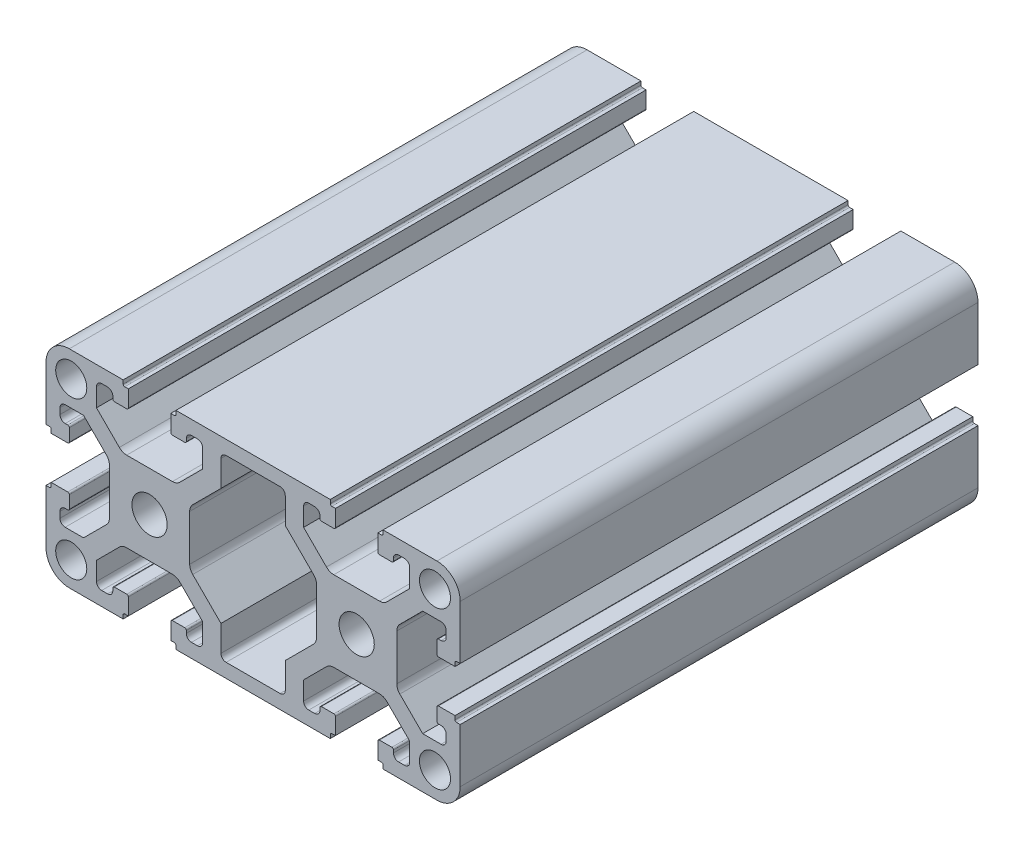
from build123d import *

# Parameters (mm, degrees)
SKETCH_1_R      = 3.4
SKETCH_1_R_2    = 3
EXTRUDE_1_DEPTH = 100


with BuildPart() as part:
    # 草图1 → 凸台-拉伸1 (new body)
    with BuildSketch(Plane.XY):
        with BuildLine():
            Line((-25.8856131, 19.848597475), (-36.2856131, 19.848597475))
            ThreePointArc((-36.2856131, 19.848597475), (-39.467593615, 18.530577991), (-40.7856131, 15.348597475))
            Line((-40.7856131, 15.348597475), (-40.7856131, 4.948597475))
            Line((-40.7856131, 4.948597475), (-40.0856131, 4.948597475))
            ThreePointArc((-40.0856131, 4.948597475), (-39.873481065, 4.86072951), (-39.7856131, 4.648597475))
            Line((-39.7856131, 4.648597475), (-39.7856131, 3.948597475))
            Line((-39.7856131, 3.948597475), (-36.5856131, 3.948597475))
            ThreePointArc((-36.5856131, 3.948597475), (-36.373481065, 4.036465441), (-36.2856131, 4.248597475))
            Line((-36.2856131, 4.248597475), (-36.2856131, 6.648597475))
            ThreePointArc((-36.2856131, 6.648597475), (-36.373481065, 6.86072951), (-36.5856131, 6.948597475))
            Line((-36.5856131, 6.948597475), (-37.0856131, 6.948597475))
            ThreePointArc((-37.0856131, 6.948597475), (-37.792719881, 7.241490694), (-38.0856131, 7.948597475))
            Line((-38.0856131, 7.948597475), (-38.0856131, 9.098597475))
            ThreePointArc((-38.0856131, 9.098597475), (-37.792719881, 9.805704257), (-37.0856131, 10.098597475))
            Line((-37.0856131, 10.098597475), (-33.538771105, 10.098597475))
            Line((-33.538771105, 10.098597475), (-29.121399537, 5.681225908))
            ThreePointArc((-29.121399537, 5.681225908), (-28.687854035, 5.03237921), (-28.5356131, 4.267012345))
            Line((-28.5356131, 4.267012345), (-28.5356131, -4.569817394))
            ThreePointArc((-28.5356131, -4.569817394), (-28.687854035, -5.335184259), (-29.121399537, -5.984030957))
            Line((-29.121399537, -5.984030957), (-33.538771105, -10.401402525))
            Line((-33.538771105, -10.401402525), (-37.0856131, -10.401402525))
            ThreePointArc((-37.0856131, -10.401402525), (-37.792719881, -10.108509306), (-38.0856131, -9.401402525))
            Line((-38.0856131, -9.401402525), (-38.0856131, -8.251402525))
            ThreePointArc((-38.0856131, -8.251402525), (-37.792719881, -7.544295743), (-37.0856131, -7.251402525))
            Line((-37.0856131, -7.251402525), (-36.5856131, -7.251402525))
            ThreePointArc((-36.5856131, -7.251402525), (-36.373481065, -7.163534559), (-36.2856131, -6.951402525))
            Line((-36.2856131, -6.951402525), (-36.2856131, -4.551402525))
            ThreePointArc((-36.2856131, -4.551402525), (-36.373481065, -4.33927049), (-36.5856131, -4.251402525))
            Line((-36.5856131, -4.251402525), (-39.7856131, -4.251402525))
            Line((-39.7856131, -4.251402525), (-39.7856131, -4.951402525))
            ThreePointArc((-39.7856131, -4.951402525), (-39.873481065, -5.163534559), (-40.0856131, -5.251402525))
            Line((-40.0856131, -5.251402525), (-40.7856131, -5.251402525))
            Line((-40.7856131, -5.251402525), (-40.7856131, -15.651402525))
            ThreePointArc((-40.7856131, -15.651402525), (-39.467593615, -18.83338304), (-36.2856131, -20.151402525))
            Line((-36.2856131, -20.151402525), (-25.8856131, -20.151402525))
            Line((-25.8856131, -20.151402525), (-25.8856131, -19.451402525))
            ThreePointArc((-25.8856131, -19.451402525), (-25.797745134, -19.23927049), (-25.5856131, -19.151402525))
            Line((-25.5856131, -19.151402525), (-24.8856131, -19.151402525))
            Line((-24.8856131, -19.151402525), (-24.8856131, -15.951402525))
            ThreePointArc((-24.8856131, -15.951402525), (-24.973481065, -15.73927049), (-25.1856131, -15.651402525))
            Line((-25.1856131, -15.651402525), (-27.5856131, -15.651402525))
            ThreePointArc((-27.5856131, -15.651402525), (-27.797745134, -15.73927049), (-27.8856131, -15.951402525))
            Line((-27.8856131, -15.951402525), (-27.8856131, -16.451402525))
            ThreePointArc((-27.8856131, -16.451402525), (-28.178506318, -17.158509306), (-28.8856131, -17.451402525))
            Line((-28.8856131, -17.451402525), (-30.0356131, -17.451402525))
            ThreePointArc((-30.0356131, -17.451402525), (-30.742719881, -17.158509306), (-31.0356131, -16.451402525))
            Line((-31.0356131, -16.451402525), (-31.0356131, -12.90456053))
            Line((-31.0356131, -12.90456053), (-26.618241532, -8.487188962))
            ThreePointArc((-26.618241532, -8.487188962), (-25.969394834, -8.05364346), (-25.204027969, -7.901402525))
            Line((-25.204027969, -7.901402525), (-16.36719823, -7.901402525))
            ThreePointArc((-16.36719823, -7.901402525), (-15.601831365, -8.05364346), (-14.952984667, -8.487188962))
            Line((-14.952984667, -8.487188962), (-10.5356131, -12.90456053))
            Line((-10.5356131, -12.90456053), (-10.5356131, -16.451402525))
            ThreePointArc((-10.5356131, -16.451402525), (-10.828506318, -17.158509306), (-11.5356131, -17.451402525))
            Line((-11.5356131, -17.451402525), (-12.6856131, -17.451402525))
            ThreePointArc((-12.6856131, -17.451402525), (-13.392719881, -17.158509306), (-13.6856131, -16.451402525))
            Line((-13.6856131, -16.451402525), (-13.6856131, -15.951402525))
            ThreePointArc((-13.6856131, -15.951402525), (-13.773481065, -15.73927049), (-13.9856131, -15.651402525))
            Line((-13.9856131, -15.651402525), (-16.3856131, -15.651402525))
            ThreePointArc((-16.3856131, -15.651402525), (-16.597745134, -15.73927049), (-16.6856131, -15.951402525))
            Line((-16.6856131, -15.951402525), (-16.6856131, -19.151402525))
            Line((-16.6856131, -19.151402525), (-15.9856131, -19.151402525))
            ThreePointArc((-15.9856131, -19.151402525), (-15.773481065, -19.23927049), (-15.6856131, -19.451402525))
            Line((-15.6856131, -19.451402525), (-15.6856131, -20.151402525))
            Line((-15.6856131, -20.151402525), (-5.2856131, -20.151402525))
            Line((-5.2856131, -20.151402525), (14.1143869, -20.151402525))
            Line((14.1143869, -20.151402525), (14.1143869, -19.451402525))
            ThreePointArc((14.1143869, -19.451402525), (14.202254866, -19.23927049), (14.4143869, -19.151402525))
            Line((14.4143869, -19.151402525), (15.1143869, -19.151402525))
            Line((15.1143869, -19.151402525), (15.1143869, -15.951402525))
            ThreePointArc((15.1143869, -15.951402525), (15.026518935, -15.73927049), (14.8143869, -15.651402525))
            Line((14.8143869, -15.651402525), (12.4143869, -15.651402525))
            ThreePointArc((12.4143869, -15.651402525), (12.202254866, -15.73927049), (12.1143869, -15.951402525))
            Line((12.1143869, -15.951402525), (12.1143869, -16.451402525))
            ThreePointArc((12.1143869, -16.451402525), (11.821493682, -17.158509306), (11.1143869, -17.451402525))
            Line((11.1143869, -17.451402525), (9.9643869, -17.451402525))
            ThreePointArc((9.9643869, -17.451402525), (9.257280119, -17.158509306), (8.9643869, -16.451402525))
            Line((8.9643869, -16.451402525), (8.9643869, -12.90456053))
            Line((8.9643869, -12.90456053), (13.381758468, -8.487188962))
            ThreePointArc((13.381758468, -8.487188962), (14.030605166, -8.05364346), (14.795972031, -7.901402525))
            Line((14.795972031, -7.901402525), (23.63280177, -7.901402525))
            ThreePointArc((23.63280177, -7.901402525), (24.398168635, -8.05364346), (25.047015333, -8.487188962))
            Line((25.047015333, -8.487188962), (29.4643869, -12.90456053))
            Line((29.4643869, -12.90456053), (29.4643869, -16.451402525))
            ThreePointArc((29.4643869, -16.451402525), (29.171493682, -17.158509306), (28.4643869, -17.451402525))
            Line((28.4643869, -17.451402525), (27.3143869, -17.451402525))
            ThreePointArc((27.3143869, -17.451402525), (26.607280119, -17.158509306), (26.3143869, -16.451402525))
            Line((26.3143869, -16.451402525), (26.3143869, -15.951402525))
            ThreePointArc((26.3143869, -15.951402525), (26.226518935, -15.73927049), (26.0143869, -15.651402525))
            Line((26.0143869, -15.651402525), (23.6143869, -15.651402525))
            ThreePointArc((23.6143869, -15.651402525), (23.402254866, -15.73927049), (23.3143869, -15.951402525))
            Line((23.3143869, -15.951402525), (23.3143869, -19.151402525))
            Line((23.3143869, -19.151402525), (24.0143869, -19.151402525))
            ThreePointArc((24.0143869, -19.151402525), (24.226518935, -19.23927049), (24.3143869, -19.451402525))
            Line((24.3143869, -19.451402525), (24.3143869, -20.151402525))
            Line((24.3143869, -20.151402525), (34.7143869, -20.151402525))
            ThreePointArc((34.7143869, -20.151402525), (37.896367416, -18.83338304), (39.2143869, -15.651402525))
            Line((39.2143869, -15.651402525), (39.2143869, -5.251402525))
            Line((39.2143869, -5.251402525), (38.5143869, -5.251402525))
            ThreePointArc((38.5143869, -5.251402525), (38.302254866, -5.163534559), (38.2143869, -4.951402525))
            Line((38.2143869, -4.951402525), (38.2143869, -4.251402525))
            Line((38.2143869, -4.251402525), (35.0143869, -4.251402525))
            ThreePointArc((35.0143869, -4.251402525), (34.802254866, -4.33927049), (34.7143869, -4.551402525))
            Line((34.7143869, -4.551402525), (34.7143869, -6.951402525))
            ThreePointArc((34.7143869, -6.951402525), (34.802254866, -7.163534559), (35.0143869, -7.251402525))
            Line((35.0143869, -7.251402525), (35.5143869, -7.251402525))
            ThreePointArc((35.5143869, -7.251402525), (36.221493682, -7.544295743), (36.5143869, -8.251402525))
            Line((36.5143869, -8.251402525), (36.5143869, -9.401402525))
            ThreePointArc((36.5143869, -9.401402525), (36.221493682, -10.108509306), (35.5143869, -10.401402525))
            Line((35.5143869, -10.401402525), (31.967544906, -10.401402525))
            Line((31.967544906, -10.401402525), (27.550173338, -5.984030957))
            ThreePointArc((27.550173338, -5.984030957), (27.116627835, -5.335184259), (26.9643869, -4.569817394))
            Line((26.9643869, -4.569817394), (26.9643869, 4.267012345))
            ThreePointArc((26.9643869, 4.267012345), (27.116627835, 5.03237921), (27.550173338, 5.681225908))
            Line((27.550173338, 5.681225908), (31.967544906, 10.098597475))
            Line((31.967544906, 10.098597475), (35.5143869, 10.098597475))
            ThreePointArc((35.5143869, 10.098597475), (36.221493682, 9.805704257), (36.5143869, 9.098597475))
            Line((36.5143869, 9.098597475), (36.5143869, 7.948597475))
            ThreePointArc((36.5143869, 7.948597475), (36.221493682, 7.241490694), (35.5143869, 6.948597475))
            Line((35.5143869, 6.948597475), (35.0143869, 6.948597475))
            ThreePointArc((35.0143869, 6.948597475), (34.802254866, 6.86072951), (34.7143869, 6.648597475))
            Line((34.7143869, 6.648597475), (34.7143869, 4.248597475))
            ThreePointArc((34.7143869, 4.248597475), (34.802254866, 4.036465441), (35.0143869, 3.948597475))
            Line((35.0143869, 3.948597475), (38.2143869, 3.948597475))
            Line((38.2143869, 3.948597475), (38.2143869, 4.648597475))
            ThreePointArc((38.2143869, 4.648597475), (38.302254866, 4.86072951), (38.5143869, 4.948597475))
            Line((38.5143869, 4.948597475), (39.2143869, 4.948597475))
            Line((39.2143869, 4.948597475), (39.2143869, 15.348597475))
            ThreePointArc((39.2143869, 15.348597475), (37.896367416, 18.530577991), (34.7143869, 19.848597475))
            Line((34.7143869, 19.848597475), (24.3143869, 19.848597475))
            Line((24.3143869, 19.848597475), (24.3143869, 19.148597475))
            ThreePointArc((24.3143869, 19.148597475), (24.226518935, 18.936465441), (24.0143869, 18.848597475))
            Line((24.0143869, 18.848597475), (23.3143869, 18.848597475))
            Line((23.3143869, 18.848597475), (23.3143869, 15.648597475))
            ThreePointArc((23.3143869, 15.648597475), (23.402254866, 15.436465441), (23.6143869, 15.348597475))
            Line((23.6143869, 15.348597475), (26.0143869, 15.348597475))
            ThreePointArc((26.0143869, 15.348597475), (26.226518935, 15.436465441), (26.3143869, 15.648597475))
            Line((26.3143869, 15.648597475), (26.3143869, 16.148597475))
            ThreePointArc((26.3143869, 16.148597475), (26.607280119, 16.855704257), (27.3143869, 17.148597475))
            Line((27.3143869, 17.148597475), (28.4643869, 17.148597475))
            ThreePointArc((28.4643869, 17.148597475), (29.171493682, 16.855704257), (29.4643869, 16.148597475))
            Line((29.4643869, 16.148597475), (29.4643869, 12.601755481))
            Line((29.4643869, 12.601755481), (25.047015333, 8.184383913))
            ThreePointArc((25.047015333, 8.184383913), (24.398168635, 7.75083841), (23.63280177, 7.598597475))
            Line((23.63280177, 7.598597475), (14.795972031, 7.598597475))
            ThreePointArc((14.795972031, 7.598597475), (14.030605166, 7.75083841), (13.381758468, 8.184383913))
            Line((13.381758468, 8.184383913), (8.9643869, 12.601755481))
            Line((8.9643869, 12.601755481), (8.9643869, 16.148597475))
            ThreePointArc((8.9643869, 16.148597475), (9.257280119, 16.855704257), (9.9643869, 17.148597475))
            Line((9.9643869, 17.148597475), (11.1143869, 17.148597475))
            ThreePointArc((11.1143869, 17.148597475), (11.821493682, 16.855704257), (12.1143869, 16.148597475))
            Line((12.1143869, 16.148597475), (12.1143869, 15.648597475))
            ThreePointArc((12.1143869, 15.648597475), (12.202254866, 15.436465441), (12.4143869, 15.348597475))
            Line((12.4143869, 15.348597475), (14.8143869, 15.348597475))
            ThreePointArc((14.8143869, 15.348597475), (15.026518935, 15.436465441), (15.1143869, 15.648597475))
            Line((15.1143869, 15.648597475), (15.1143869, 18.848597475))
            Line((15.1143869, 18.848597475), (14.4143869, 18.848597475))
            ThreePointArc((14.4143869, 18.848597475), (14.202254866, 18.936465441), (14.1143869, 19.148597475))
            Line((14.1143869, 19.148597475), (14.1143869, 19.848597475))
            Line((14.1143869, 19.848597475), (3.7143869, 19.848597475))
            Line((3.7143869, 19.848597475), (-5.2856131, 19.848597475))
            Line((-5.2856131, 19.848597475), (-15.6856131, 19.848597475))
            Line((-15.6856131, 19.848597475), (-15.6856131, 19.148597475))
            ThreePointArc((-15.6856131, 19.148597475), (-15.773481065, 18.936465441), (-15.9856131, 18.848597475))
            Line((-15.9856131, 18.848597475), (-16.6856131, 18.848597475))
            Line((-16.6856131, 18.848597475), (-16.6856131, 15.648597475))
            ThreePointArc((-16.6856131, 15.648597475), (-16.597745134, 15.436465441), (-16.3856131, 15.348597475))
            Line((-16.3856131, 15.348597475), (-13.9856131, 15.348597475))
            ThreePointArc((-13.9856131, 15.348597475), (-13.773481065, 15.436465441), (-13.6856131, 15.648597475))
            Line((-13.6856131, 15.648597475), (-13.6856131, 16.148597475))
            ThreePointArc((-13.6856131, 16.148597475), (-13.392719881, 16.855704257), (-12.6856131, 17.148597475))
            Line((-12.6856131, 17.148597475), (-11.5356131, 17.148597475))
            ThreePointArc((-11.5356131, 17.148597475), (-10.828506318, 16.855704257), (-10.5356131, 16.148597475))
            Line((-10.5356131, 16.148597475), (-10.5356131, 12.601755481))
            Line((-10.5356131, 12.601755481), (-14.952984667, 8.184383913))
            ThreePointArc((-14.952984667, 8.184383913), (-15.601831365, 7.75083841), (-16.36719823, 7.598597475))
            Line((-16.36719823, 7.598597475), (-25.204027969, 7.598597475))
            ThreePointArc((-25.204027969, 7.598597475), (-25.969394834, 7.75083841), (-26.618241532, 8.184383913))
            Line((-26.618241532, 8.184383913), (-31.0356131, 12.601755481))
            Line((-31.0356131, 12.601755481), (-31.0356131, 16.148597475))
            ThreePointArc((-31.0356131, 16.148597475), (-30.742719881, 16.855704257), (-30.0356131, 17.148597475))
            Line((-30.0356131, 17.148597475), (-28.8856131, 17.148597475))
            ThreePointArc((-28.8856131, 17.148597475), (-28.178506318, 16.855704257), (-27.8856131, 16.148597475))
            Line((-27.8856131, 16.148597475), (-27.8856131, 15.648597475))
            ThreePointArc((-27.8856131, 15.648597475), (-27.797745134, 15.436465441), (-27.5856131, 15.348597475))
            Line((-27.5856131, 15.348597475), (-25.1856131, 15.348597475))
            ThreePointArc((-25.1856131, 15.348597475), (-24.973481065, 15.436465441), (-24.8856131, 15.648597475))
            Line((-24.8856131, 15.648597475), (-24.8856131, 18.848597475))
            Line((-24.8856131, 18.848597475), (-25.5856131, 18.848597475))
            ThreePointArc((-25.5856131, 18.848597475), (-25.797745134, 18.936465441), (-25.8856131, 19.148597475))
            Line((-25.8856131, 19.148597475), (-25.8856131, 19.848597475))
        make_face()
        with Locations((-20.7856131, -0.151402525)):
            Circle(SKETCH_1_R, mode=Mode.SUBTRACT)
        with Locations((-35.9106131, 14.973597475)):
            Circle(SKETCH_1_R_2, mode=Mode.SUBTRACT)
        with Locations((-35.9106131, -15.276402525)):
            Circle(SKETCH_1_R_2, mode=Mode.SUBTRACT)
        with Locations((19.2143869, -0.151402525)):
            Circle(SKETCH_1_R, mode=Mode.SUBTRACT)
        with Locations((34.3393869, 14.973597475)):
            Circle(SKETCH_1_R_2, mode=Mode.SUBTRACT)
        with Locations((34.3393869, -15.276402525)):
            Circle(SKETCH_1_R_2, mode=Mode.SUBTRACT)
        with BuildLine():
            Line((-6.9956131, -11.438244519), (-12.449826662, -5.984030957))
            ThreePointArc((-12.449826662, -5.984030957), (-12.883372165, -5.335184259), (-13.0356131, -4.569817394))
            Line((-13.0356131, -4.569817394), (-13.0356131, 4.267012345))
            ThreePointArc((-13.0356131, 4.267012345), (-12.883372165, 5.03237921), (-12.449826662, 5.681225908))
            Line((-12.449826662, 5.681225908), (-6.9956131, 11.13543947))
            Line((-6.9956131, 11.13543947), (-6.9956131, 16.148597475))
            ThreePointArc((-6.9956131, 16.148597475), (-6.702719881, 16.855704257), (-5.9956131, 17.148597475))
            Line((-5.9956131, 17.148597475), (4.4243869, 17.148597475))
            ThreePointArc((4.4243869, 17.148597475), (5.131493682, 16.855704257), (5.4243869, 16.148597475))
            Line((5.4243869, 16.148597475), (5.4243869, 11.13543947))
            Line((5.4243869, 11.13543947), (10.878600463, 5.681225908))
            ThreePointArc((10.878600463, 5.681225908), (11.312145965, 5.03237921), (11.4643869, 4.267012345))
            Line((11.4643869, 4.267012345), (11.4643869, -4.569817394))
            ThreePointArc((11.4643869, -4.569817394), (11.312145965, -5.335184259), (10.878600463, -5.984030957))
            Line((10.878600463, -5.984030957), (5.4243869, -11.438244519))
            Line((5.4243869, -11.438244519), (5.4243869, -16.451402525))
            ThreePointArc((5.4243869, -16.451402525), (5.131493682, -17.158509306), (4.4243869, -17.451402525))
            Line((4.4243869, -17.451402525), (-5.9956131, -17.451402525))
            ThreePointArc((-5.9956131, -17.451402525), (-6.702719881, -17.158509306), (-6.9956131, -16.451402525))
            Line((-6.9956131, -16.451402525), (-6.9956131, -11.438244519))
        make_face(mode=Mode.SUBTRACT)
    extrude(amount=EXTRUDE_1_DEPTH)


solid = part.part
